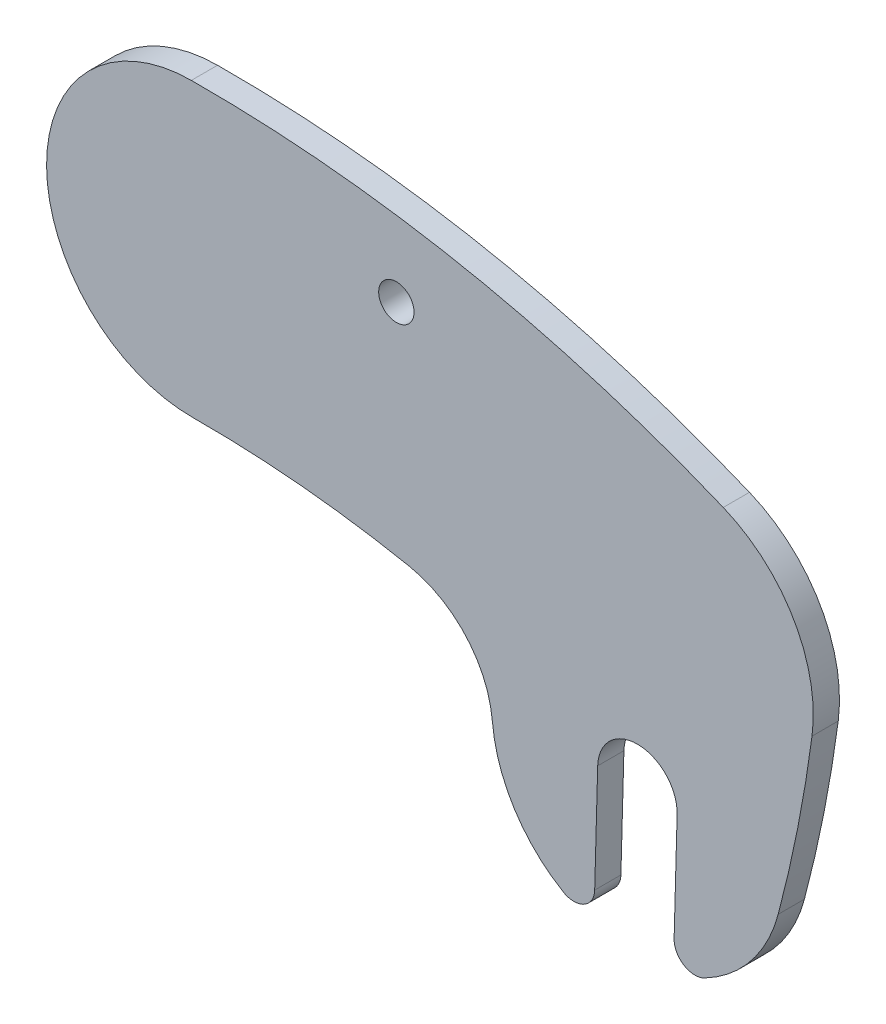
from build123d import *

# Parameters (mm, degrees)
BOSS_EXTRUDE1_DEPTH = 3.2004
BOSS_EXTRUDE2_START = -3.2004
BOSS_EXTRUDE2_DEPTH = 3.2004
FILLET1_R           = 12.7
CUT_EXTRUDE3_DEPTH  = 3.2004
FILLET2_R           = 2.54
SKETCH9_R           = 2.159
CUT_EXTRUDE4_DEPTH  = 3.2004
CUT_EXTRUDE5_DEPTH  = 3.2004


with BuildPart() as part:
    # Sketch1 → Boss-Extrude1 (new body)
    with BuildSketch(Plane.XY):
        with BuildLine():
            ThreePointArc((-6.790095085, 16.435726481), (57.15, 29.123460788), (121.090095085, 16.435726481))
            ThreePointArc((121.090095085, 16.435726481), (130.735726481, -6.790095085), (107.509904915, -16.435726481))
            ThreePointArc((107.509904915, -16.435726481), (57.15, -6.442730812), (6.790095085, -16.435726481))
            ThreePointArc((6.790095085, -16.435726481), (-16.435726481, -6.790095085), (-6.790095085, 16.435726481))
        make_face()
    extrude(amount=BOSS_EXTRUDE1_DEPTH)

    # Sketch3 → Boss-Extrude2 (add)
    with BuildSketch(Plane.XY.offset(3.2004).offset(BOSS_EXTRUDE2_START)):
        with BuildLine():
            ThreePointArc((96.670173634, 2.329746452), (116.629746452, 17.629826366), (131.929826366, -2.329746452))
            ThreePointArc((131.929826366, -2.329746452), (130.197200475, -12.850112517), (127.798590387, -23.238893209))
            ThreePointArc((127.798590387, -23.238893209), (106.05729345, -35.879818808), (93.416367852, -14.138521872))
            ThreePointArc((93.416367852, -14.138521872), (95.305538892, -5.956206736), (96.670173634, 2.329746452))
        make_face()
    extrude(amount=BOSS_EXTRUDE2_DEPTH)

    # Fillet1
    fillet1_edges = [part.edges().sort_by_distance(p)[0] for p in [
        (94.035611584, -11.705568295, 1.6002),
    ]]
    fillet(fillet1_edges, radius=FILLET1_R)

    # Sketch7 → Cut-Extrude3 (cut)
    with BuildSketch(Plane.XY.offset(3.2004)):
        with BuildLine():
            Line((115.457037918, -18.822354151), (114.672565979, -47.28804272))
            Line((114.672565979, -47.28804272), (104.973448381, -47.020749498))
            Line((104.973448381, -47.020749498), (105.75792032, -18.55506093))
            ThreePointArc((105.75792032, -18.55506093), (110.74112573, -13.839148742), (115.457037918, -18.822354151))
        make_face()
    extrude(amount=-CUT_EXTRUDE3_DEPTH, mode=Mode.SUBTRACT)

    # Fillet2
    fillet2_edges = [part.edges().sort_by_distance(p)[0] for p in [
        (105.286613182, -35.65711589, 1.6002),
        (114.98573078, -35.924409111, 1.6002),
    ]]
    fillet(fillet2_edges, radius=FILLET2_R)

    # Sketch9 → Cut-Extrude4 (cut)
    with BuildSketch(Plane(origin=(0, 0, 0), x_dir=(-1, 0, 0), z_dir=(0, 0, -1))):
        with Locations((-81.171495532, 18.191790938)):
            Circle(SKETCH9_R)
    extrude(amount=-CUT_EXTRUDE4_DEPTH, mode=Mode.SUBTRACT)

    # Sketch10 → Cut-Extrude5 (cut)
    with BuildSketch(Plane(origin=(0, 0, 0), x_dir=(-1, 0, 0), z_dir=(0, 0, -1))):
        with BuildLine():
            Line((-56.134756458, 29.120383205), (25.761959957, 49.584410296))
            Line((25.761959957, 49.584410296), (33.027370327, -48.953888357))
            Line((33.027370327, -48.953888357), (-56.350383293, -6.445154749))
            ThreePointArc((-56.350383293, -6.445154749), (-38.459800898, 11.22980081), (-56.134756458, 29.120383205))
        make_face()
    extrude(amount=-CUT_EXTRUDE5_DEPTH, mode=Mode.SUBTRACT)


solid = part.part
